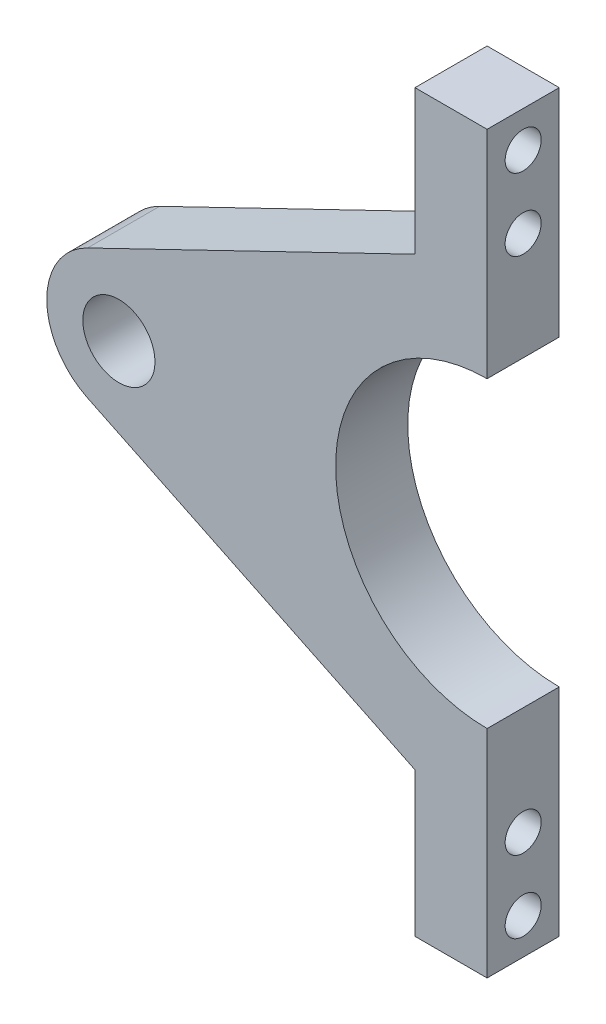
from build123d import *

# Parameters (mm, degrees)
BOSS_EXTRUDE1_DEPTH = 10
SKETCH2_R           = 5
CUT_EXTRUDE1_DEPTH  = 83.27950738
SKETCH3_R           = 2.5
CUT_EXTRUDE2_DEPTH  = 76.159549646


with BuildPart() as part:
    # Sketch1 → Boss-Extrude1 (new body)
    with BuildSketch(Plane.XY):
        with BuildLine():
            Line((0, 24.299679487), (0, 54.25))
            Line((0, 54.25), (-10, 54.25))
            Line((-10, 54.25), (-10, 34.25))
            Line((-10, 34.25), (-55.400247003, 12.302884399))
            ThreePointArc((-55.400247003, 12.302884399), (-61.047971586, 3.299679487), (-55.400247003, -5.703525425))
            Line((-55.400247003, -5.703525425), (-10, -27.650641026))
            Line((-10, -27.650641026), (-10, -47.650641026))
            Line((-10, -47.650641026), (0, -47.650641026))
            Line((0, -47.650641026), (0, -17.700320513))
            ThreePointArc((0, -17.700320513), (-21, 3.299679487), (0, 24.299679487))
        make_face()
    extrude(amount=-BOSS_EXTRUDE1_DEPTH)

    # Sketch2 → Cut-Extrude1 (cut, through all)
    with BuildSketch(Plane.XY):
        with Locations((-51.047971586, 3.299679487)):
            Circle(SKETCH2_R)
    extrude(amount=-CUT_EXTRUDE1_DEPTH, mode=Mode.SUBTRACT)

    # Sketch3 → Cut-Extrude2 (cut, through all)
    with BuildSketch(Plane.ZY.offset(10)):
        with Locations((-5, 49.25)):
            Circle(SKETCH3_R)
        with Locations((-5, 39.25)):
            Circle(SKETCH3_R)
        with Locations(Location((-5, -32.650641026, 0), (0, 0, 180))):
            Circle(SKETCH3_R)
        with Locations(Location((-5, -42.650641026, 0), (0, 0, 180))):
            Circle(SKETCH3_R)
    extrude(amount=-CUT_EXTRUDE2_DEPTH, mode=Mode.SUBTRACT)


solid = part.part
